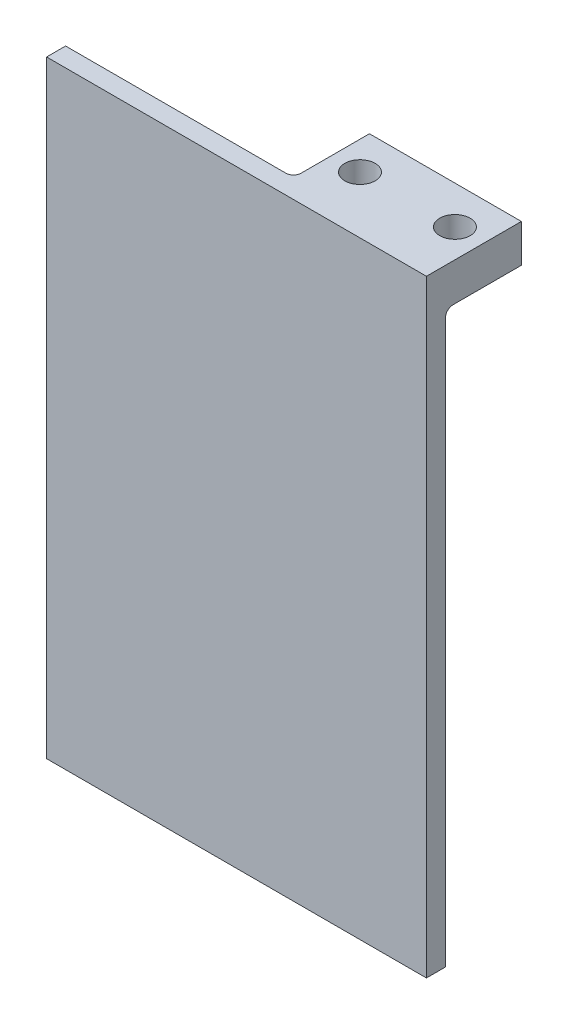
from build123d import *

# Parameters (mm, degrees)
SKETCH_1_W          = 100
SKETCH_1_H          = 160
EXTRUDE_1_DEPTH     = 5
SKETCH_2_W          = 40
SKETCH_2_H          = 20
EXTRUDE_2_DEPTH     = 10
SKETCH_3_R          = 4
CUT_EXTRUDE_1_DEPTH = 10
FILLET_1_R          = 2


with BuildPart() as part:
    # 草图1 → 凸台-拉伸1 (new body)
    with BuildSketch(Plane.XY):
        Rectangle(SKETCH_1_W, SKETCH_1_H)
    extrude(amount=EXTRUDE_1_DEPTH)

    # 草图2 → 凸台-拉伸2 (add)
    with BuildSketch(Plane(origin=(0, 80, 0), x_dir=(1, 0, 0), z_dir=(0, 1, 0))):
        with Locations((30, 10)):
            Rectangle(SKETCH_2_W, SKETCH_2_H)
    extrude(amount=-EXTRUDE_2_DEPTH)

    # 草图3 → 切除-拉伸1 (cut)
    with BuildSketch(Plane(origin=(0, 80, 0), x_dir=(1, 0, 0), z_dir=(0, 1, 0))):
        with Locations(Location((17.5, 10, 0), (0, 0, 270))):
            Circle(SKETCH_3_R)
        with Locations(Location((42.5, 10, 0), (0, 0, 270))):
            Circle(SKETCH_3_R)
    extrude(amount=-CUT_EXTRUDE_1_DEPTH, mode=Mode.SUBTRACT)

    # 圆角1
    fillet_1_edges = [part.edges().sort_by_distance(p)[0] for p in [
        (30, 70, 0),
        (10, 75, 0),
    ]]
    fillet(fillet_1_edges, radius=FILLET_1_R)


solid = part.part
